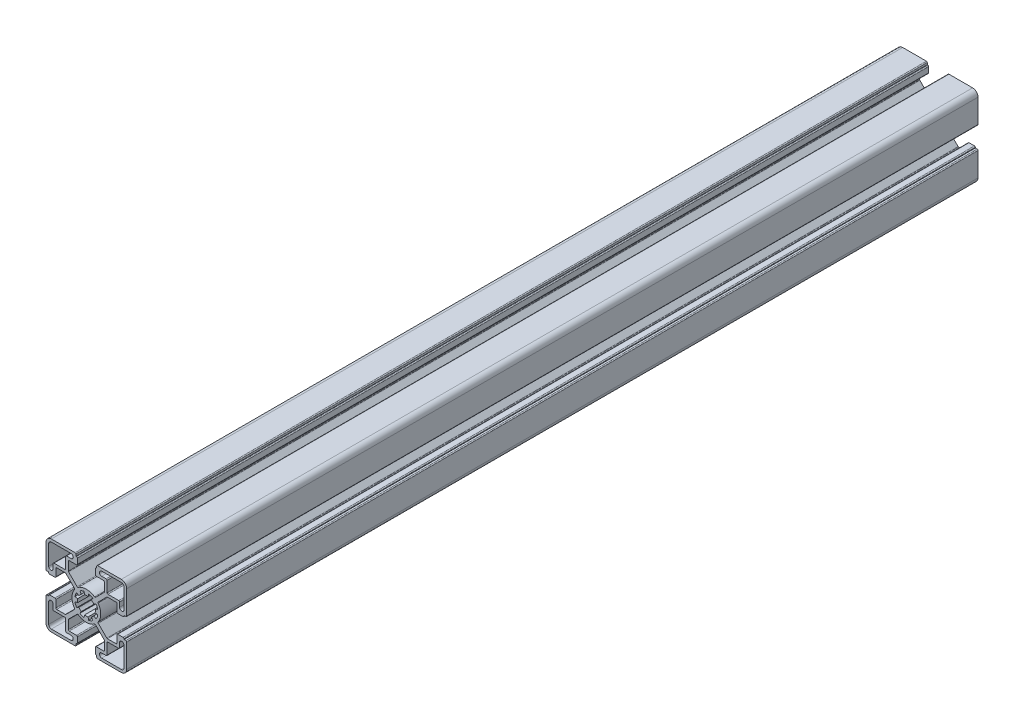
from build123d import *

# Parameters (mm, degrees)
BOSS_EXTRUDE1_DEPTH      = 152.4
BOSS_EXTRUDE1_DEPTH_BACK = 152.4
SKETCH3_R                = 5
FILLET1_R                = 0.5
CUT_EXTRUDE1_DEPTH       = 307.456424309
BOSS_EXTRUDE2_DEPTH      = 169.95


with BuildPart() as part:
    # Sketch3 → Boss-Extrude1 (new, two sides: drawn at the far end of the back side and taken through both)
    with BuildSketch(Plane.XY.offset(-BOSS_EXTRUDE1_DEPTH_BACK)):
        with BuildLine():
            Line((-11.55, -10.05), (-6.356915373, -4.856915373))
            ThreePointArc((-6.356915373, -4.856915373), (-8, 0), (-6.356915373, 4.856915373))
            Line((-6.356915373, 4.856915373), (-11.55, 10.05))
            Line((-11.55, 10.05), (-17.025, 10.05))
            Line((-17.025, 10.05), (-17.025, 5))
            Line((-17.025, 5), (-21, 5))
            Line((-21, 5), (-21, 5.8))
            Line((-21, 5.8), (-22.5, 5.8))
            Line((-22.5, 5.8), (-22.5, 19.5))
            ThreePointArc((-22.5, 19.5), (-21.621320344, 21.621320344), (-19.5, 22.5))
            Line((-19.5, 22.5), (-5.8, 22.5))
            Line((-5.8, 22.5), (-5.8, 21))
            Line((-5.8, 21), (-5, 21))
            Line((-5, 21), (-5, 17.025))
            Line((-5, 17.025), (-10.05, 17.025))
            Line((-10.05, 17.025), (-10.05, 11.55))
            Line((-10.05, 11.55), (-4.856915373, 6.356915373))
            ThreePointArc((-4.856915373, 6.356915373), (0, 8), (4.856915373, 6.356915373))
            Line((4.856915373, 6.356915373), (10.05, 11.55))
            Line((10.05, 11.55), (10.05, 17.025))
            Line((10.05, 17.025), (5, 17.025))
            Line((5, 17.025), (5, 21))
            Line((5, 21), (5.8, 21))
            Line((5.8, 21), (5.8, 22.5))
            Line((5.8, 22.5), (19.5, 22.5))
            ThreePointArc((19.5, 22.5), (21.621320344, 21.621320344), (22.5, 19.5))
            Line((22.5, 19.5), (22.5, 5.8))
            Line((22.5, 5.8), (21, 5.8))
            Line((21, 5.8), (21, 5))
            Line((21, 5), (17.025, 5))
            Line((17.025, 5), (17.025, 10.05))
            Line((17.025, 10.05), (11.55, 10.05))
            Line((11.55, 10.05), (6.356915373, 4.856915373))
            ThreePointArc((6.356915373, 4.856915373), (8, 0), (6.356915373, -4.856915373))
            Line((6.356915373, -4.856915373), (11.55, -10.05))
            Line((11.55, -10.05), (17.025, -10.05))
            Line((17.025, -10.05), (17.025, -5))
            Line((17.025, -5), (21, -5))
            Line((21, -5), (21, -5.8))
            Line((21, -5.8), (22.5, -5.8))
            Line((22.5, -5.8), (22.5, -19.5))
            ThreePointArc((22.5, -19.5), (21.621320344, -21.621320344), (19.5, -22.5))
            Line((19.5, -22.5), (5.8, -22.5))
            Line((5.8, -22.5), (5.8, -21))
            Line((5.8, -21), (5, -21))
            Line((5, -21), (5, -17.025))
            Line((5, -17.025), (10.05, -17.025))
            Line((10.05, -17.025), (10.05, -11.55))
            Line((10.05, -11.55), (4.856915373, -6.356915373))
            ThreePointArc((4.856915373, -6.356915373), (0, -8), (-4.856915373, -6.356915373))
            Line((-4.856915373, -6.356915373), (-10.05, -11.55))
            Line((-10.05, -11.55), (-10.05, -17.025))
            Line((-10.05, -17.025), (-5, -17.025))
            Line((-5, -17.025), (-5, -21))
            Line((-5, -21), (-5.8, -21))
            Line((-5.8, -21), (-5.8, -22.5))
            Line((-5.8, -22.5), (-19.5, -22.5))
            ThreePointArc((-19.5, -22.5), (-21.621320344, -21.621320344), (-22.5, -19.5))
            Line((-22.5, -19.5), (-22.5, -5.8))
            Line((-22.5, -5.8), (-21, -5.8))
            Line((-21, -5.8), (-21, -5))
            Line((-21, -5), (-17.025, -5))
            Line((-17.025, -5), (-17.025, -10.05))
            Line((-17.025, -10.05), (-11.55, -10.05))
        make_face()
        with Locations(Location((0, 0, 0), (0, 0, 180))):
            Circle(SKETCH3_R, mode=Mode.SUBTRACT)
        with BuildLine():
            Line((-21, 8.5375), (-21, 19.5))
            ThreePointArc((-21, 19.5), (-20.560660172, 20.560660172), (-19.5, 21))
            Line((-19.5, 21), (-8.5375, 21))
            ThreePointArc((-8.5375, 21), (-7.3, 19.7625), (-8.5375, 18.525))
            Line((-8.5375, 18.525), (-11.55, 18.525))
            Line((-11.55, 18.525), (-11.55, 11.55))
            Line((-11.55, 11.55), (-18.525, 11.55))
            Line((-18.525, 11.55), (-18.525, 8.5375))
            ThreePointArc((-18.525, 8.5375), (-19.7625, 7.3), (-21, 8.5375))
        make_face(mode=Mode.SUBTRACT)
        with BuildLine():
            Line((8.5375, 21), (19.5, 21))
            ThreePointArc((19.5, 21), (20.560660172, 20.560660172), (21, 19.5))
            Line((21, 19.5), (21, 8.5375))
            ThreePointArc((21, 8.5375), (19.7625, 7.3), (18.525, 8.5375))
            Line((18.525, 8.5375), (18.525, 11.55))
            Line((18.525, 11.55), (11.55, 11.55))
            Line((11.55, 11.55), (11.55, 18.525))
            Line((11.55, 18.525), (8.5375, 18.525))
            ThreePointArc((8.5375, 18.525), (7.3, 19.7625), (8.5375, 21))
        make_face(mode=Mode.SUBTRACT)
        with BuildLine():
            Line((21, -8.5375), (21, -19.5))
            ThreePointArc((21, -19.5), (20.560660172, -20.560660172), (19.5, -21))
            Line((19.5, -21), (8.5375, -21))
            ThreePointArc((8.5375, -21), (7.3, -19.7625), (8.5375, -18.525))
            Line((8.5375, -18.525), (11.55, -18.525))
            Line((11.55, -18.525), (11.55, -11.55))
            Line((11.55, -11.55), (18.525, -11.55))
            Line((18.525, -11.55), (18.525, -8.5375))
            ThreePointArc((18.525, -8.5375), (19.7625, -7.3), (21, -8.5375))
        make_face(mode=Mode.SUBTRACT)
        with BuildLine():
            Line((-8.5375, -21), (-19.5, -21))
            ThreePointArc((-19.5, -21), (-20.560660172, -20.560660172), (-21, -19.5))
            Line((-21, -19.5), (-21, -8.5375))
            ThreePointArc((-21, -8.5375), (-19.7625, -7.3), (-18.525, -8.5375))
            Line((-18.525, -8.5375), (-18.525, -11.55))
            Line((-18.525, -11.55), (-11.55, -11.55))
            Line((-11.55, -11.55), (-11.55, -18.525))
            Line((-11.55, -18.525), (-8.5375, -18.525))
            ThreePointArc((-8.5375, -18.525), (-7.3, -19.7625), (-8.5375, -21))
        make_face(mode=Mode.SUBTRACT)
    extrude(amount=BOSS_EXTRUDE1_DEPTH + BOSS_EXTRUDE1_DEPTH_BACK)

    # Fillet1
    fillet1_edges = [part.edges().sort_by_distance(p)[0] for p in [
        (-11.55, -18.525, 0),
        (-11.55, -11.55, 0),
        (18.525, -11.55, 0),
        (11.55, -11.55, 0),
        (11.55, -18.525, 0),
        (11.55, 18.525, 0),
        (11.55, 11.55, 0),
        (18.525, 11.55, 0),
        (-18.525, 11.55, 0),
        (-11.55, 11.55, 0),
        (-11.55, 18.525, 0),
        (6.356915373, -4.856915373, 0),
        (11.55, -10.05, 0),
        (17.025, -10.05, 0),
        (17.025, -5, 0),
        (21, -5, 0),
        (22.5, -5.8, 0),
        (5.8, -22.5, 0),
        (5, -21, 0),
        (5, -17.025, 0),
        (10.05, -17.025, 0),
        (10.05, -11.55, 0),
        (4.856915373, -6.356915373, 0),
        (-4.856915373, -6.356915373, 0),
        (-10.05, -11.55, 0),
        (-10.05, -17.025, 0),
        (-5, -17.025, 0),
        (-5, -21, 0),
        (-5.8, -22.5, 0),
        (-22.5, -5.8, 0),
        (-21, -5, 0),
        (-17.025, -5, 0),
        (-17.025, -10.05, 0),
        (-11.55, -10.05, 0),
        (-6.356915373, -4.856915373, 0),
        (-6.356915373, 4.856915373, 0),
        (-11.55, 10.05, 0),
        (-17.025, 10.05, 0),
        (-17.025, 5, 0),
        (-21, 5, 0),
        (-22.5, 5.8, 0),
        (-5.8, 22.5, 0),
        (-5, 21, 0),
        (-5, 17.025, 0),
        (-10.05, 17.025, 0),
        (-10.05, 11.55, 0),
        (-4.856915373, 6.356915373, 0),
        (4.856915373, 6.356915373, 0),
        (10.05, 11.55, 0),
        (10.05, 17.025, 0),
        (5, 17.025, 0),
        (5, 21, 0),
        (5.8, 22.5, 0),
        (22.5, 5.8, 0),
        (21, 5, 0),
        (17.025, 5, 0),
        (11.55, 10.05, 0),
        (6.356915373, 4.856915373, 0),
    ]]
    fillet(fillet1_edges, radius=FILLET1_R)

    # Sketch4 → Cut-Extrude1 (cut, through all)
    with BuildSketch(Plane.XY.offset(152.4)):
        with BuildLine():
            Line((-1.268087093, 6.375104323), (-0.97545161, 4.903926402))
            ThreePointArc((-0.97545161, 4.903926402), (-1.913417162, 4.619397663), (-2.777851165, 4.157348062))
            Line((-2.777851165, 4.157348062), (-3.611206515, 5.40455248))
            ThreePointArc((-3.611206515, 5.40455248), (-2.48744231, 6.005216961), (-1.268087093, 6.375104323))
        make_face()
        with BuildLine():
            Line((1.268087093, 6.375104323), (0.97545161, 4.903926402))
            ThreePointArc((0.97545161, 4.903926402), (1.913417162, 4.619397663), (2.777851165, 4.157348062))
            Line((2.777851165, 4.157348062), (3.611206515, 5.40455248))
            ThreePointArc((3.611206515, 5.40455248), (2.48744231, 6.005216961), (1.268087093, 6.375104323))
        make_face()
        with BuildLine():
            Line((5.40455248, 3.611206515), (4.157348062, 2.777851165))
            ThreePointArc((4.157348062, 2.777851165), (4.619397663, 1.913417162), (4.903926402, 0.97545161))
            Line((4.903926402, 0.97545161), (6.375104323, 1.268087093))
            ThreePointArc((6.375104323, 1.268087093), (6.005216961, 2.48744231), (5.40455248, 3.611206515))
        make_face()
        with BuildLine():
            Line((6.375104323, -1.268087093), (4.903926402, -0.97545161))
            ThreePointArc((4.903926402, -0.97545161), (4.619397663, -1.913417162), (4.157348062, -2.777851165))
            Line((4.157348062, -2.777851165), (5.40455248, -3.611206515))
            ThreePointArc((5.40455248, -3.611206515), (6.005216961, -2.48744231), (6.375104323, -1.268087093))
        make_face()
        with BuildLine():
            Line((3.611206515, -5.40455248), (2.777851165, -4.157348062))
            ThreePointArc((2.777851165, -4.157348062), (1.913417162, -4.619397663), (0.97545161, -4.903926402))
            Line((0.97545161, -4.903926402), (1.268087093, -6.375104323))
            ThreePointArc((1.268087093, -6.375104323), (2.48744231, -6.005216961), (3.611206515, -5.40455248))
        make_face()
        with BuildLine():
            Line((-1.268087093, -6.375104323), (-0.97545161, -4.903926402))
            ThreePointArc((-0.97545161, -4.903926402), (-1.913417162, -4.619397663), (-2.777851165, -4.157348062))
            Line((-2.777851165, -4.157348062), (-3.611206515, -5.40455248))
            ThreePointArc((-3.611206515, -5.40455248), (-2.48744231, -6.005216961), (-1.268087093, -6.375104323))
        make_face()
        with BuildLine():
            Line((-5.40455248, -3.611206515), (-4.157348062, -2.777851165))
            ThreePointArc((-4.157348062, -2.777851165), (-4.619397663, -1.913417162), (-4.903926402, -0.97545161))
            Line((-4.903926402, -0.97545161), (-6.375104323, -1.268087093))
            ThreePointArc((-6.375104323, -1.268087093), (-6.005216961, -2.48744231), (-5.40455248, -3.611206515))
        make_face()
        with BuildLine():
            Line((-6.375104323, 1.268087093), (-4.903926402, 0.97545161))
            ThreePointArc((-4.903926402, 0.97545161), (-4.619397663, 1.913417162), (-4.157348062, 2.777851165))
            Line((-4.157348062, 2.777851165), (-5.40455248, 3.611206515))
            ThreePointArc((-5.40455248, 3.611206515), (-6.005216961, 2.48744231), (-6.375104323, 1.268087093))
        make_face()
    extrude(amount=-CUT_EXTRUDE1_DEPTH, mode=Mode.SUBTRACT)

    # Sketch5 → Boss-Extrude2 (add)
    with BuildSketch(Plane.XY.offset(152.4)):
        with BuildLine():
            Line((22.5, -19.5), (22.5, -6.3))
            ThreePointArc((22.5, -6.3), (22.353553391, -5.946446609), (22, -5.8))
            Line((22, -5.8), (21, -5.8))
            Line((21, -5.8), (21, -5.5))
            ThreePointArc((21, -5.5), (20.853553391, -5.146446609), (20.5, -5))
            Line((20.5, -5), (17.525, -5))
            ThreePointArc((17.525, -5), (17.171446609, -5.146446609), (17.025, -5.5))
            Line((17.025, -5.5), (17.025, -9.55))
            ThreePointArc((17.025, -9.55), (16.878553391, -9.903553391), (16.525, -10.05))
            Line((16.525, -10.05), (11.757106781, -10.05))
            ThreePointArc((11.757106781, -10.05), (11.565765065, -10.011939766), (11.403553391, -9.903553391))
            Line((11.403553391, -9.903553391), (6.658229, -5.158229))
            ThreePointArc((6.658229, -5.158229), (6.513911961, -4.850773717), (6.599324603, -4.522047632))
            ThreePointArc((6.599324603, -4.522047632), (8, 0), (6.599324603, 4.522047632))
            ThreePointArc((6.599324603, 4.522047632), (6.513911961, 4.850773717), (6.658229, 5.158229))
            Line((6.658229, 5.158229), (11.403553391, 9.903553391))
            ThreePointArc((11.403553391, 9.903553391), (11.565765065, 10.011939766), (11.757106781, 10.05))
            Line((11.757106781, 10.05), (17.025, 10.05))
            Line((17.025, 10.05), (17.025, 5.5))
            ThreePointArc((17.025, 5.5), (17.171446609, 5.146446609), (17.525, 5))
            Line((17.525, 5), (20.5, 5))
            ThreePointArc((20.5, 5), (20.853553391, 5.146446609), (21, 5.5))
            Line((21, 5.5), (21, 5.8))
            Line((21, 5.8), (22, 5.8))
            ThreePointArc((22, 5.8), (22.353553391, 5.946446609), (22.5, 6.3))
            Line((22.5, 6.3), (22.5, 19.5))
            ThreePointArc((22.5, 19.5), (21.621320344, 21.621320344), (19.5, 22.5))
            Line((19.5, 22.5), (6.3, 22.5))
            ThreePointArc((6.3, 22.5), (5.946446609, 22.353553391), (5.8, 22))
            Line((5.8, 22), (5.8, 21))
            Line((5.8, 21), (5.5, 21))
            ThreePointArc((5.5, 21), (5.146446609, 20.853553391), (5, 20.5))
            Line((5, 20.5), (5, 17.525))
            ThreePointArc((5, 17.525), (5.146446609, 17.171446609), (5.5, 17.025))
            Line((5.5, 17.025), (9.55, 17.025))
            ThreePointArc((9.55, 17.025), (9.903553391, 16.878553391), (10.05, 16.525))
            Line((10.05, 16.525), (10.05, 11.757106781))
            ThreePointArc((10.05, 11.757106781), (10.011939766, 11.565765065), (9.903553391, 11.403553391))
            Line((9.903553391, 11.403553391), (5.158229, 6.658229))
            ThreePointArc((5.158229, 6.658229), (4.850773717, 6.513911961), (4.522047632, 6.599324603))
            ThreePointArc((4.522047632, 6.599324603), (0, 8), (-4.522047632, 6.599324603))
            ThreePointArc((-4.522047632, 6.599324603), (-4.850773717, 6.513911961), (-5.158229, 6.658229))
            Line((-5.158229, 6.658229), (-9.903553391, 11.403553391))
            ThreePointArc((-9.903553391, 11.403553391), (-10.011939766, 11.565765065), (-10.05, 11.757106781))
            Line((-10.05, 11.757106781), (-10.05, 16.525))
            ThreePointArc((-10.05, 16.525), (-9.903553391, 16.878553391), (-9.55, 17.025))
            Line((-9.55, 17.025), (-5.5, 17.025))
            ThreePointArc((-5.5, 17.025), (-5.146446609, 17.171446609), (-5, 17.525))
            Line((-5, 17.525), (-5, 20.5))
            ThreePointArc((-5, 20.5), (-5.146446609, 20.853553391), (-5.5, 21))
            Line((-5.5, 21), (-5.8, 21))
            Line((-5.8, 21), (-5.8, 22))
            ThreePointArc((-5.8, 22), (-5.946446609, 22.353553391), (-6.3, 22.5))
            Line((-6.3, 22.5), (-19.5, 22.5))
            ThreePointArc((-19.5, 22.5), (-21.621320344, 21.621320344), (-22.5, 19.5))
            Line((-22.5, 19.5), (-22.5, 6.3))
            ThreePointArc((-22.5, 6.3), (-22.353553391, 5.946446609), (-22, 5.8))
            Line((-22, 5.8), (-21, 5.8))
            Line((-21, 5.8), (-21, 5.5))
            ThreePointArc((-21, 5.5), (-20.853553391, 5.146446609), (-20.5, 5))
            Line((-20.5, 5), (-17.525, 5))
            ThreePointArc((-17.525, 5), (-17.171446609, 5.146446609), (-17.025, 5.5))
            Line((-17.025, 5.5), (-17.025, 9.55))
            ThreePointArc((-17.025, 9.55), (-16.878553391, 9.903553391), (-16.525, 10.05))
            Line((-16.525, 10.05), (-11.757106781, 10.05))
            ThreePointArc((-11.757106781, 10.05), (-11.565765065, 10.011939766), (-11.403553391, 9.903553391))
            Line((-11.403553391, 9.903553391), (-6.658229, 5.158229))
            ThreePointArc((-6.658229, 5.158229), (-6.513911961, 4.850773717), (-6.599324603, 4.522047632))
            ThreePointArc((-6.599324603, 4.522047632), (-8, 0), (-6.599324603, -4.522047632))
            ThreePointArc((-6.599324603, -4.522047632), (-6.513911961, -4.850773717), (-6.658229, -5.158229))
            Line((-6.658229, -5.158229), (-11.403553391, -9.903553391))
            ThreePointArc((-11.403553391, -9.903553391), (-11.565765065, -10.011939766), (-11.757106781, -10.05))
            Line((-11.757106781, -10.05), (-16.525, -10.05))
            ThreePointArc((-16.525, -10.05), (-16.878553391, -9.903553391), (-17.025, -9.55))
            Line((-17.025, -9.55), (-17.025, -5.5))
            ThreePointArc((-17.025, -5.5), (-17.171446609, -5.146446609), (-17.525, -5))
            Line((-17.525, -5), (-20.5, -5))
            ThreePointArc((-20.5, -5), (-20.853553391, -5.146446609), (-21, -5.5))
            Line((-21, -5.5), (-21, -5.8))
            Line((-21, -5.8), (-22, -5.8))
            ThreePointArc((-22, -5.8), (-22.353553391, -5.946446609), (-22.5, -6.3))
            Line((-22.5, -6.3), (-22.5, -19.5))
            ThreePointArc((-22.5, -19.5), (-21.621320344, -21.621320344), (-19.5, -22.5))
            Line((-19.5, -22.5), (-6.3, -22.5))
            ThreePointArc((-6.3, -22.5), (-5.946446609, -22.353553391), (-5.8, -22))
            Line((-5.8, -22), (-5.8, -21))
            Line((-5.8, -21), (-5.5, -21))
            ThreePointArc((-5.5, -21), (-5.146446609, -20.853553391), (-5, -20.5))
            Line((-5, -20.5), (-5, -17.525))
            ThreePointArc((-5, -17.525), (-5.146446609, -17.171446609), (-5.5, -17.025))
            Line((-5.5, -17.025), (-9.55, -17.025))
            ThreePointArc((-9.55, -17.025), (-9.903553391, -16.878553391), (-10.05, -16.525))
            Line((-10.05, -16.525), (-10.05, -11.757106781))
            ThreePointArc((-10.05, -11.757106781), (-10.011939766, -11.565765065), (-9.903553391, -11.403553391))
            Line((-9.903553391, -11.403553391), (-5.158229, -6.658229))
            ThreePointArc((-5.158229, -6.658229), (-4.850773717, -6.513911961), (-4.522047632, -6.599324603))
            ThreePointArc((-4.522047632, -6.599324603), (0, -8), (4.522047632, -6.599324603))
            ThreePointArc((4.522047632, -6.599324603), (4.850773717, -6.513911961), (5.158229, -6.658229))
            Line((5.158229, -6.658229), (9.903553391, -11.403553391))
            ThreePointArc((9.903553391, -11.403553391), (10.011939766, -11.565765065), (10.05, -11.757106781))
            Line((10.05, -11.757106781), (10.05, -16.525))
            ThreePointArc((10.05, -16.525), (9.903553391, -16.878553391), (9.55, -17.025))
            Line((9.55, -17.025), (5.5, -17.025))
            ThreePointArc((5.5, -17.025), (5.146446609, -17.171446609), (5, -17.525))
            Line((5, -17.525), (5, -20.5))
            ThreePointArc((5, -20.5), (5.146446609, -20.853553391), (5.5, -21))
            Line((5.5, -21), (5.8, -21))
            Line((5.8, -21), (5.8, -22))
            ThreePointArc((5.8, -22), (5.946446609, -22.353553391), (6.3, -22.5))
            Line((6.3, -22.5), (19.5, -22.5))
            ThreePointArc((19.5, -22.5), (21.621320344, -21.621320344), (22.5, -19.5))
        make_face()
        with BuildLine():
            Line((-11.55, -18.025), (-11.55, -12.05))
            ThreePointArc((-11.55, -12.05), (-11.696446609, -11.696446609), (-12.05, -11.55))
            Line((-12.05, -11.55), (-18.525, -11.55))
            Line((-18.525, -11.55), (-18.525, -8.5375))
            ThreePointArc((-18.525, -8.5375), (-19.7625, -7.3), (-21, -8.5375))
            Line((-21, -8.5375), (-21, -19.5))
            ThreePointArc((-21, -19.5), (-20.560660172, -20.560660172), (-19.5, -21))
            Line((-19.5, -21), (-8.5375, -21))
            ThreePointArc((-8.5375, -21), (-7.3, -19.7625), (-8.5375, -18.525))
            Line((-8.5375, -18.525), (-11.05, -18.525))
            ThreePointArc((-11.05, -18.525), (-11.403553391, -18.378553391), (-11.55, -18.025))
        make_face(mode=Mode.SUBTRACT)
        with BuildLine():
            Line((-0.97545161, 4.903926402), (-1.268087093, 6.375104323))
            ThreePointArc((-1.268087093, 6.375104323), (-2.48744231, 6.005216961), (-3.611206515, 5.40455248))
            Line((-3.611206515, 5.40455248), (-2.777851165, 4.157348062))
            ThreePointArc((-2.777851165, 4.157348062), (-3.535533906, 3.535533906), (-4.157348062, 2.777851165))
            Line((-4.157348062, 2.777851165), (-5.40455248, 3.611206515))
            ThreePointArc((-5.40455248, 3.611206515), (-6.005216961, 2.48744231), (-6.375104323, 1.268087093))
            Line((-6.375104323, 1.268087093), (-4.903926402, 0.97545161))
            ThreePointArc((-4.903926402, 0.97545161), (-5, 0), (-4.903926402, -0.97545161))
            Line((-4.903926402, -0.97545161), (-6.375104323, -1.268087093))
            ThreePointArc((-6.375104323, -1.268087093), (-6.005216961, -2.48744231), (-5.40455248, -3.611206515))
            Line((-5.40455248, -3.611206515), (-4.157348062, -2.777851165))
            ThreePointArc((-4.157348062, -2.777851165), (-3.535533906, -3.535533906), (-2.777851165, -4.157348062))
            Line((-2.777851165, -4.157348062), (-3.611206515, -5.40455248))
            ThreePointArc((-3.611206515, -5.40455248), (-2.48744231, -6.005216961), (-1.268087093, -6.375104323))
            Line((-1.268087093, -6.375104323), (-0.97545161, -4.903926402))
            ThreePointArc((-0.97545161, -4.903926402), (0, -5), (0.97545161, -4.903926402))
            Line((0.97545161, -4.903926402), (1.268087093, -6.375104323))
            ThreePointArc((1.268087093, -6.375104323), (2.48744231, -6.005216961), (3.611206515, -5.40455248))
            Line((3.611206515, -5.40455248), (2.777851165, -4.157348062))
            ThreePointArc((2.777851165, -4.157348062), (3.535533906, -3.535533906), (4.157348062, -2.777851165))
            Line((4.157348062, -2.777851165), (5.40455248, -3.611206515))
            ThreePointArc((5.40455248, -3.611206515), (6.005216961, -2.48744231), (6.375104323, -1.268087093))
            Line((6.375104323, -1.268087093), (4.903926402, -0.97545161))
            ThreePointArc((4.903926402, -0.97545161), (5, 0), (4.903926402, 0.97545161))
            Line((4.903926402, 0.97545161), (6.375104323, 1.268087093))
            ThreePointArc((6.375104323, 1.268087093), (6.005216961, 2.48744231), (5.40455248, 3.611206515))
            Line((5.40455248, 3.611206515), (4.157348062, 2.777851165))
            ThreePointArc((4.157348062, 2.777851165), (3.535533906, 3.535533906), (2.777851165, 4.157348062))
            Line((2.777851165, 4.157348062), (3.611206515, 5.40455248))
            ThreePointArc((3.611206515, 5.40455248), (2.48744231, 6.005216961), (1.268087093, 6.375104323))
            Line((1.268087093, 6.375104323), (0.97545161, 4.903926402))
            ThreePointArc((0.97545161, 4.903926402), (0, 5), (-0.97545161, 4.903926402))
        make_face(mode=Mode.SUBTRACT)
        with BuildLine():
            Line((18.025, -11.55), (12.05, -11.55))
            ThreePointArc((12.05, -11.55), (11.696446609, -11.696446609), (11.55, -12.05))
            Line((11.55, -12.05), (11.55, -18.025))
            ThreePointArc((11.55, -18.025), (11.403553391, -18.378553391), (11.05, -18.525))
            Line((11.05, -18.525), (8.5375, -18.525))
            ThreePointArc((8.5375, -18.525), (7.3, -19.7625), (8.5375, -21))
            Line((8.5375, -21), (19.5, -21))
            ThreePointArc((19.5, -21), (20.560660172, -20.560660172), (21, -19.5))
            Line((21, -19.5), (21, -8.5375))
            ThreePointArc((21, -8.5375), (19.7625, -7.3), (18.525, -8.5375))
            Line((18.525, -8.5375), (18.525, -11.05))
            ThreePointArc((18.525, -11.05), (18.378553391, -11.403553391), (18.025, -11.55))
        make_face(mode=Mode.SUBTRACT)
        with BuildLine():
            Line((11.55, 18.025), (11.55, 12.05))
            ThreePointArc((11.55, 12.05), (11.696446609, 11.696446609), (12.05, 11.55))
            Line((12.05, 11.55), (18.025, 11.55))
            ThreePointArc((18.025, 11.55), (18.378553391, 11.403553391), (18.525, 11.05))
            Line((18.525, 11.05), (18.525, 8.5375))
            ThreePointArc((18.525, 8.5375), (19.7625, 7.3), (21, 8.5375))
            Line((21, 8.5375), (21, 19.5))
            ThreePointArc((21, 19.5), (20.560660172, 20.560660172), (19.5, 21))
            Line((19.5, 21), (8.5375, 21))
            ThreePointArc((8.5375, 21), (7.3, 19.7625), (8.5375, 18.525))
            Line((8.5375, 18.525), (11.05, 18.525))
            ThreePointArc((11.05, 18.525), (11.403553391, 18.378553391), (11.55, 18.025))
        make_face(mode=Mode.SUBTRACT)
        with BuildLine():
            Line((-18.025, 11.55), (-12.05, 11.55))
            ThreePointArc((-12.05, 11.55), (-11.696446609, 11.696446609), (-11.55, 12.05))
            Line((-11.55, 12.05), (-11.55, 18.025))
            ThreePointArc((-11.55, 18.025), (-11.403553391, 18.378553391), (-11.05, 18.525))
            Line((-11.05, 18.525), (-8.5375, 18.525))
            ThreePointArc((-8.5375, 18.525), (-7.3, 19.7625), (-8.5375, 21))
            Line((-8.5375, 21), (-19.5, 21))
            ThreePointArc((-19.5, 21), (-20.560660172, 20.560660172), (-21, 19.5))
            Line((-21, 19.5), (-21, 8.5375))
            ThreePointArc((-21, 8.5375), (-19.7625, 7.3), (-18.525, 8.5375))
            Line((-18.525, 8.5375), (-18.525, 11.05))
            ThreePointArc((-18.525, 11.05), (-18.378553391, 11.403553391), (-18.025, 11.55))
        make_face(mode=Mode.SUBTRACT)
    extrude(amount=BOSS_EXTRUDE2_DEPTH)


solid = part.part
